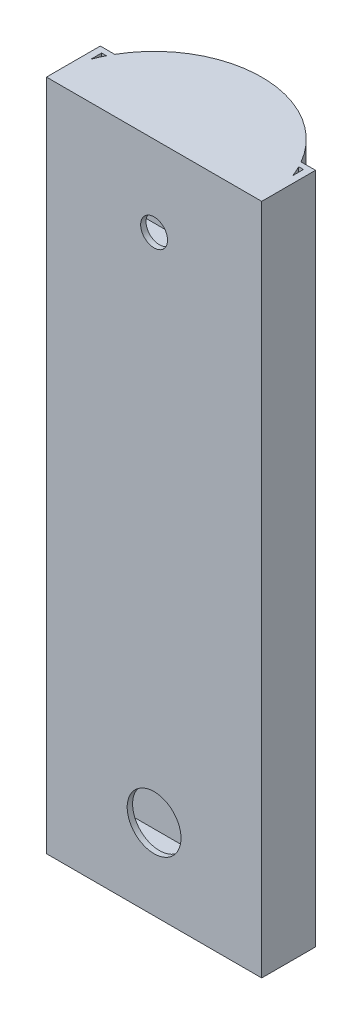
from build123d import *

# Parameters (mm, degrees)
SKETCH1_W           = 80
SKETCH1_H           = 20
BOSS_EXTRUDE1_DEPTH = 200
SKETCH2_W           = 75
SKETCH2_H           = 16
CUT_EXTRUDE1_DEPTH  = 190
SKETCH3_R           = 7.5
CUT_EXTRUDE3_DEPTH  = 10
SKETCH4_W           = 80
SKETCH4_H           = 20
SKETCH4_W_2         = 75
SKETCH4_H_2         = 16
BOSS_EXTRUDE2_DEPTH = 50
SKETCH5_R           = 5
CUT_EXTRUDE4_DEPTH  = 10
REVOLVE1_ANGLE      = 180
SKETCH8_R           = 10
CUT_EXTRUDE5_DEPTH  = 10
SKETCH7_R           = 5
BOSS_EXTRUDE3_DEPTH = 15
SKETCH9_R           = 4
CUT_EXTRUDE6_DEPTH  = 30


with BuildPart() as part:
    # Sketch1 → Boss-Extrude1 (new body)
    with BuildSketch(Plane(origin=(0, 0, 0), x_dir=(1, 0, 0), z_dir=(0, 1, 0))):
        Rectangle(SKETCH1_W, SKETCH1_H)
    extrude(amount=BOSS_EXTRUDE1_DEPTH)

    # Sketch2 → Cut-Extrude1 (cut)
    with BuildSketch(Plane(origin=(0, 200, 0), x_dir=(1, 0, 0), z_dir=(0, 1, 0))):
        Rectangle(SKETCH2_W, SKETCH2_H)
    extrude(amount=-CUT_EXTRUDE1_DEPTH, mode=Mode.SUBTRACT)

    # Sketch3 → Cut-Extrude3 (cut)
    with BuildSketch(Plane(origin=(0, 0, -10), x_dir=(-1, 0, 0), z_dir=(0, 0, -1))):
        with Locations(Location((0, 40, 0), (0, 0, 180))):
            Circle(SKETCH3_R)
    extrude(amount=-CUT_EXTRUDE3_DEPTH, mode=Mode.SUBTRACT)

    # Sketch4 → Boss-Extrude2 (add)
    with BuildSketch(Plane(origin=(0, 200, 0), x_dir=(1, 0, 0), z_dir=(0, 1, 0))):
        Rectangle(SKETCH4_W, SKETCH4_H)
        Rectangle(SKETCH4_W_2, SKETCH4_H_2, mode=Mode.SUBTRACT)
    extrude(amount=BOSS_EXTRUDE2_DEPTH)

    # Sketch5 → Cut-Extrude4 (cut)
    with BuildSketch(Plane.XY.offset(10)):
        with Locations((0, 220)):
            Circle(SKETCH5_R)
    extrude(amount=-CUT_EXTRUDE4_DEPTH, mode=Mode.SUBTRACT)

    # Sketch6 → Revolve1 (revolve)
    with BuildSketch(Plane.XY.offset(10)):
        Polygon((0, 250), (40, 250), (40, 200), (0, 200), (0, 205), (35, 205), (35, 245), (0, 245), align=None)
    revolve(axis=Axis((0, 0, 10), (0, 1, 0)), revolution_arc=REVOLVE1_ANGLE)

    # Sketch8 → Cut-Extrude5 (cut)
    with BuildSketch(Plane.XY.offset(10)):
        with Locations((0, 30)):
            Circle(SKETCH8_R)
    extrude(amount=-CUT_EXTRUDE5_DEPTH, mode=Mode.SUBTRACT)

    # Sketch7 → Boss-Extrude3 (add)
    with BuildSketch(Plane.XZ.offset(-200)):
        with Locations(Location((0, -20, 0), (0, 0, 180))):
            Circle(SKETCH7_R)
    extrude(amount=BOSS_EXTRUDE3_DEPTH)

    # Sketch9 → Cut-Extrude6 (cut)
    with BuildSketch(Plane.XZ.offset(-185)):
        with Locations((0, -20)):
            Circle(SKETCH9_R)
    extrude(amount=-CUT_EXTRUDE6_DEPTH, mode=Mode.SUBTRACT)


solid = part.part
